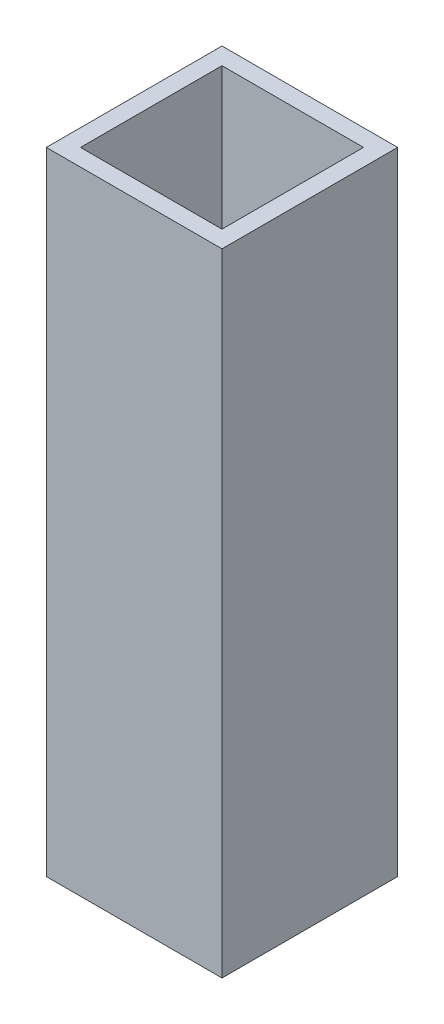
from build123d import *

# Parameters (mm, degrees)
SKETCH1_W           = 12.35
SKETCH1_H           = 12.35
BOSS_EXTRUDE1_DEPTH = 44.4
SHELL1_T            = -1.2


with BuildPart() as part:
    # Sketch1 → Boss-Extrude1 (new body)
    with BuildSketch(Plane(origin=(0, 0, 0), x_dir=(1, 0, 0), z_dir=(0, 1, 0))):
        Rectangle(SKETCH1_W, SKETCH1_H)
    extrude(amount=BOSS_EXTRUDE1_DEPTH)

    # Shell1
    shell1_openings = [part.faces().sort_by_distance(p)[0] for p in [
        (0, 44.4, 0),
    ]]
    offset(amount=SHELL1_T, openings=shell1_openings, kind=Kind.INTERSECTION)


solid = part.part
